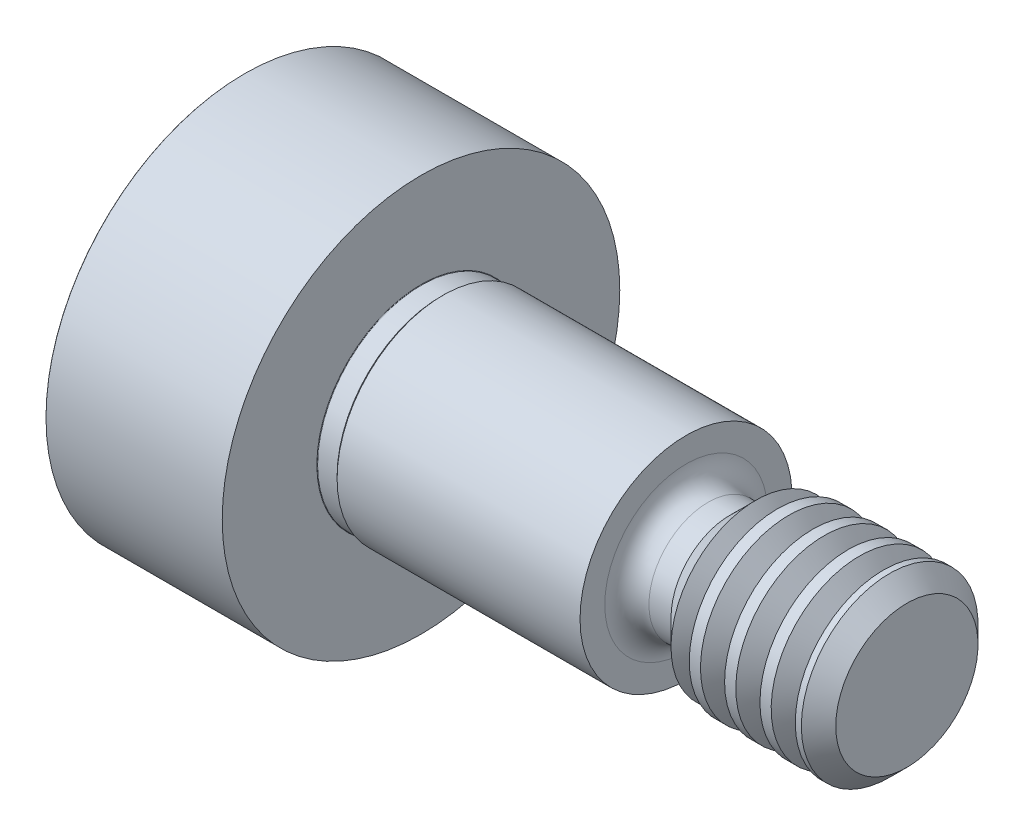
from build123d import *

# Parameters (mm, degrees)
CHAMFER1_SIZE   = 0.01
HEX_2_DEPTH     = 2.4
THDSCHPAT_COUNT = 4
THDSCHPAT_PITCH = 0.8


with BuildPart() as part:
    # BodySke → BaseBody (revolve)
    with BuildSketch(Plane.XY, mode=Mode.PRIVATE) as basebody_sk:
        with BuildLine():
            Line((0, 0), (0, 4.5))
            Line((0, 4.5), (4, 4.5))
            Line((4, 4.5), (4, 2.36))
            ThreePointArc((4, 2.36), (4.002928932, 2.352928932), (4.01, 2.35))
            Line((4.01, 2.35), (4.45, 2.35))
            Line((4.45, 2.35), (4.5, 2.4))
            Line((4.5, 2.4), (10, 2.4))
            Line((10, 2.4), (10, 1.84))
            ThreePointArc((10, 1.84), (10.146446609, 1.486446609), (10.5, 1.34))
            Line((10.5, 1.34), (11, 1.34))
            Line((11, 1.34), (11.66, 2))
            Line((11.66, 2), (14.61, 2))
            Line((14.61, 2), (15, 1.61))
            Line((15, 1.61), (15, 0))
            Line((15, 0), (0, 0))
        make_face()
    revolve(basebody_sk.sketch.rotate(Axis((-6.35, 0, 0), (1, 0, 0)), 90), axis=Axis((-6.35, 0, 0), (1, 0, 0)))

    # Chamfer1
    chamfer1_edges = [part.edges().sort_by_distance(p)[0] for p in [
        (0, 0, -4.5),
    ]]
    chamfer(chamfer1_edges, length=CHAMFER1_SIZE)

    # Sketch2 → PreBroach (revolve, cut)
    with BuildSketch(Plane.XY, mode=Mode.PRIVATE) as prebroach_sk:
        Polygon((0, 1.04), (2, 1.04), (2.60044428, 0), (0, 0), align=None)
    revolve(prebroach_sk.sketch.rotate(Axis((0, 0, 0), (1, 0, 0)), 90), axis=Axis((0, 0, 0), (1, 0, 0)), mode=Mode.SUBTRACT)

    # Sketch3 → Hex 2 (cut)
    with BuildSketch(Plane.ZY):
        Polygon((-1.04, -0.60044428), (-1.04, 0.60044428), (0, 1.20088856), (1.04, 0.60044428), (1.04, -0.60044428), (0, -1.20088856), align=None)
    extrude(amount=-HEX_2_DEPTH, mode=Mode.SUBTRACT)

    # ThdSchSke → ThreadSchematic (revolve, cut)
    with BuildSketch(Plane.XY):
        Polygon((11.8, -1.61), (11.246836045, -2.4), (11.246836045, -3), (12.353163955, -3), (12.353163955, -2.4), align=None)
    threadschematic = revolve(axis=Axis((-3.175, 0, 0), (1, 0, 0)), mode=Mode.SUBTRACT)

    # ThdSchPat: ThreadSchematic ×4
    with Locations(*[(i * THDSCHPAT_PITCH, 0, 0) for i in range(1, THDSCHPAT_COUNT)]):
        add(threadschematic, mode=Mode.SUBTRACT)


solid = part.part
